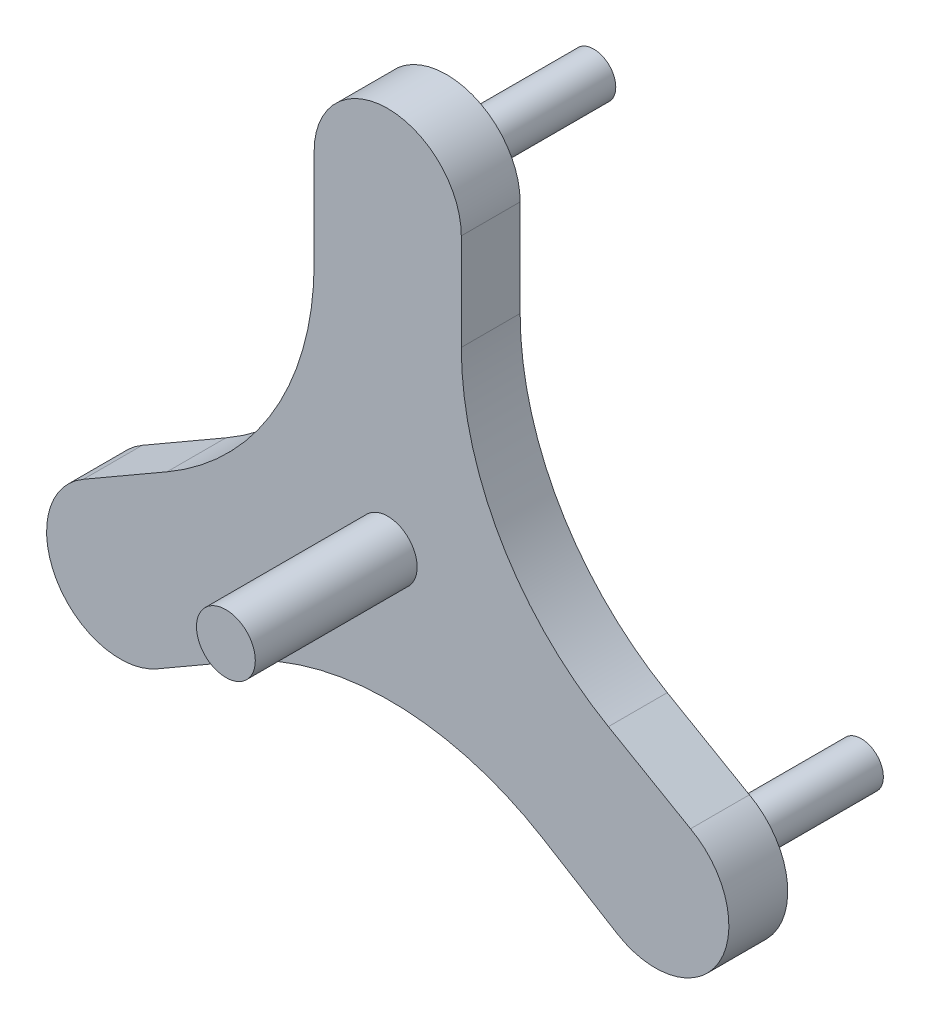
from build123d import *

# Parameters (mm, degrees)
EXTRUDE_1_DEPTH = 2
SKETCH_2_R      = 0.75
EXTRUDE_2_DEPTH = 5
SKETCH_4_R      = 1
EXTRUDE_3_DEPTH = 5.5


with BuildPart() as part:
    # Эскиз1 → Бобышка-Вытянуть1 (new body)
    with BuildSketch(Plane.XY):
        with BuildLine():
            Line((-1.3027145, -2.134628779), (-3.80950787, -0.604790849))
            ThreePointArc((-3.80950787, -0.604790849), (-8.89711015, 0.858483074), (-14.018822021, -0.480522171))
            Line((-14.018822021, -0.480522171), (-16.936533206, -2.16506351))
            ThreePointArc((-16.936533206, -2.16506351), (-20.351596716, -1.25), (-19.436533206, 2.16506351))
            Line((-19.436533206, 2.16506351), (-16.593266604, 3.806624248))
            ThreePointArc((-16.593266604, 3.806624248), (-12.933012566, 7.466878286), (-11.593266604, 12.466878286))
            Line((-11.593266604, 12.466878286), (-11.593266604, 15.749999763))
            ThreePointArc((-11.593266604, 15.749999763), (-9.093266603, 18.249999764), (-6.593266603, 15.749999763))
            Line((-6.593266603, 15.749999763), (-6.593266603, 12.466878286))
            ThreePointArc((-6.593266603, 12.466878286), (-5.253520641, 7.466878286), (-1.593266603, 3.806624248))
            Line((-1.593266603, 3.806624248), (1.1972855, 2.19549824))
            ThreePointArc((1.1972855, 2.19549824), (2.165705155, -1.250370454), (-1.3027145, -2.134628779))
        make_face()
    extrude(amount=EXTRUDE_1_DEPTH)

    # Эскиз2 → Бобышка-Вытянуть2 (add)
    with BuildSketch(Plane(origin=(0, 0, 0), x_dir=(-1, 0, 0), z_dir=(0, 0, -1))):
        with Locations(Location((0, 0, 0), (0, 0, 180))):
            Circle(SKETCH_2_R)
        with Locations(Location((9.093266603, 15.749999763, 0), (0, 0, 180))):
            Circle(SKETCH_2_R)
        with Locations(Location((18.186533206, 0, 0), (0, 0, 180))):
            Circle(SKETCH_2_R)
    extrude(amount=EXTRUDE_2_DEPTH)

    # Эскиз4 → Бобышка-Вытянуть3 (add)
    with BuildSketch(Plane.XY.offset(2)):
        with Locations((-9.093266603, 5.249999921)):
            Circle(SKETCH_4_R)
    extrude(amount=EXTRUDE_3_DEPTH)


solid = part.part
